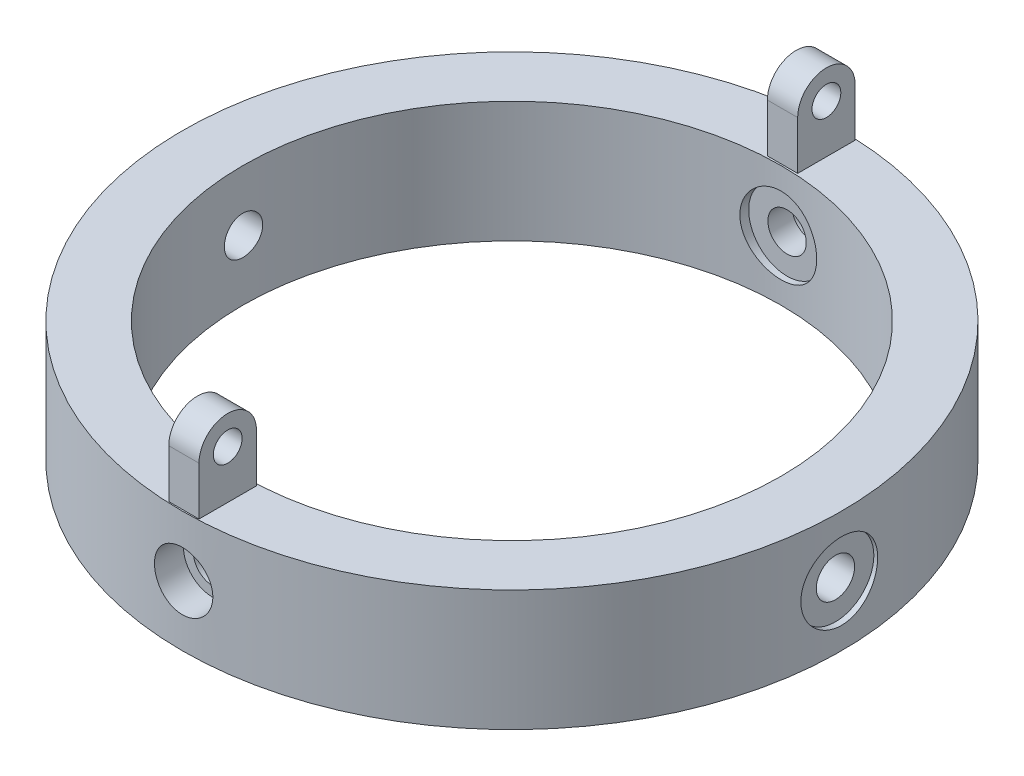
from build123d import *

# Parameters (mm, degrees)
SKETCH1_R           = 54.5
SKETCH1_R_2         = 44.5
BOSS_EXTRUDE1_DEPTH = 20
CUT_EXTRUDE1_REACH  = 81.627
SKETCH2_R           = 3.175
CUT_EXTRUDE2_REACH  = 81.627
SKETCH2_2_R         = 3.175
SKETCH3_W           = 5
SKETCH3_H           = 9.5
BOSS_EXTRUDE2_DEPTH = 13
CUT_EXTRUDE3_REACH  = 87.488
CUT_EXTRUDE4_REACH  = 87.392
SKETCH5_R           = 2.38125
SKETCH6_R           = 3.175
CUT_EXTRUDE5_DEPTH  = 180
SKETCH8_R           = 4.826
CUT_EXTRUDE6_DEPTH  = 5
SKETCH9_R           = 6.35
CUT_EXTRUDE7_DEPTH  = 1
SKETCH10_R          = 6.35
CUT_EXTRUDE9_DEPTH  = 1


with BuildPart() as part:
    # Sketch1 → Boss-Extrude1 (new body)
    with BuildSketch(Plane(origin=(0, 0, 0), x_dir=(1, 0, 0), z_dir=(0, 1, 0))):
        Circle(SKETCH1_R)
        Circle(SKETCH1_R_2, mode=Mode.SUBTRACT)
    extrude(amount=BOSS_EXTRUDE1_DEPTH)

    # Sketch2 → Cut-Extrude1 (cut, up to next)
    with BuildSketch(Plane.XY, mode=Mode.PRIVATE) as cut_extrude1_sk1:
        with Locations((0, 10)):
            Circle(SKETCH2_R)
    cut_extrude1_tool1 = extrude(cut_extrude1_sk1.sketch, amount=-CUT_EXTRUDE1_REACH, mode=Mode.PRIVATE) & part.part
    add(cut_extrude1_tool1.solids().sort_by_distance((0, 10, 0))[0], mode=Mode.SUBTRACT)

    # Sketch2<2> → Cut-Extrude2 (cut, up to next)
    with BuildSketch(Plane.XY, mode=Mode.PRIVATE) as cut_extrude2_sk1:
        with Locations((0, 10)):
            Circle(SKETCH2_2_R)
    cut_extrude2_tool1 = extrude(cut_extrude2_sk1.sketch, amount=CUT_EXTRUDE2_REACH, mode=Mode.PRIVATE) & part.part
    add(cut_extrude2_tool1.solids().sort_by_distance((0, 10, 0))[0], mode=Mode.SUBTRACT)

    # Sketch3 → Boss-Extrude2 (add)
    with BuildSketch(Plane(origin=(0, 20, 0), x_dir=(1, 0, 0), z_dir=(0, 1, 0))):
        with Locations((0, -49.5)):
            Rectangle(SKETCH3_W, SKETCH3_H)
    boss_extrude2 = extrude(amount=BOSS_EXTRUDE2_DEPTH)

    # Sketch4 → Cut-Extrude3 (cut, up to next)
    with BuildSketch(Plane(origin=(2.5, 0, 0), x_dir=(0, 0, -1), z_dir=(1, 0, 0)), mode=Mode.PRIVATE) as cut_extrude3_sk1:
        with BuildLine():
            Line((-54.25, 28), (-54.25, 33))
            Line((-54.25, 33), (-44.75, 33))
            Line((-44.75, 33), (-44.75, 28))
            ThreePointArc((-44.75, 28), (-49.5, 32.75), (-54.25, 28))
        make_face()
    cut_extrude3_tool1 = extrude(cut_extrude3_sk1.sketch, amount=-CUT_EXTRUDE3_REACH, mode=Mode.PRIVATE) & part.part
    cut_extrude3 = cut_extrude3_tool1.solids().sort_by_distance((2.5, 32.857355, 49.5))[0]
    add(cut_extrude3, mode=Mode.SUBTRACT)

    # Sketch5 → Cut-Extrude4 (cut, up to next)
    with BuildSketch(Plane(origin=(2.5, 0, 0), x_dir=(0, 0, -1), z_dir=(1, 0, 0)), mode=Mode.PRIVATE) as cut_extrude4_sk1:
        with Locations((-49.5, 28)):
            Circle(SKETCH5_R)
    cut_extrude4_tool1 = extrude(cut_extrude4_sk1.sketch, amount=-CUT_EXTRUDE4_REACH, mode=Mode.PRIVATE) & part.part
    cut_extrude4 = cut_extrude4_tool1.solids().sort_by_distance((2.5, 28, 49.5))[0]
    add(cut_extrude4, mode=Mode.SUBTRACT)

    # Mirror1: Boss-Extrude2, Cut-Extrude3, Cut-Extrude4 across plane
    add(boss_extrude2.mirror(Plane.XY))
    add(cut_extrude3.mirror(Plane.XY), mode=Mode.SUBTRACT)
    add(cut_extrude4.mirror(Plane.XY), mode=Mode.SUBTRACT)

    # Sketch6 → Cut-Extrude5 (cut)
    with BuildSketch(Plane(origin=(54.5, 0, 0), x_dir=(0, 0, -1), z_dir=(1, 0, 0))):
        with Locations((0, 10)):
            Circle(SKETCH6_R)
    extrude(amount=-CUT_EXTRUDE5_DEPTH, mode=Mode.SUBTRACT)

    # Sketch8 → Cut-Extrude6 (cut)
    with BuildSketch(Plane.XY.offset(54.5)):
        with Locations((0, 10)):
            Circle(SKETCH8_R)
    cut_extrude6 = extrude(amount=-CUT_EXTRUDE6_DEPTH, mode=Mode.SUBTRACT)

    # Mirror2: Cut-Extrude6 across plane
    add(cut_extrude6.mirror(Plane.XY), mode=Mode.SUBTRACT)

    # Sketch9 → Cut-Extrude7 (cut)
    with BuildSketch(Plane(origin=(54.5, 0, 0), x_dir=(0, 0, -1), z_dir=(1, 0, 0))):
        with Locations((0, 10)):
            Circle(SKETCH9_R)
    cut_extrude7 = extrude(amount=-CUT_EXTRUDE7_DEPTH, mode=Mode.SUBTRACT)

    # Mirror3: Cut-Extrude7 across plane
    add(cut_extrude7.mirror(Plane(origin=(0, 0, 0), x_dir=(0, 0, 1), z_dir=(1, 0, 0))), mode=Mode.SUBTRACT)

    # Sketch10 → Cut-Extrude9 (cut, symmetric)
    with BuildSketch(Plane.XY.offset(44.5)):
        with Locations((0, 10)):
            Circle(SKETCH10_R)
    cut_extrude9 = extrude(amount=CUT_EXTRUDE9_DEPTH, both=True, mode=Mode.SUBTRACT)

    # Mirror4: Cut-Extrude9 across plane
    add(cut_extrude9.mirror(Plane.XY), mode=Mode.SUBTRACT)


solid = part.part
